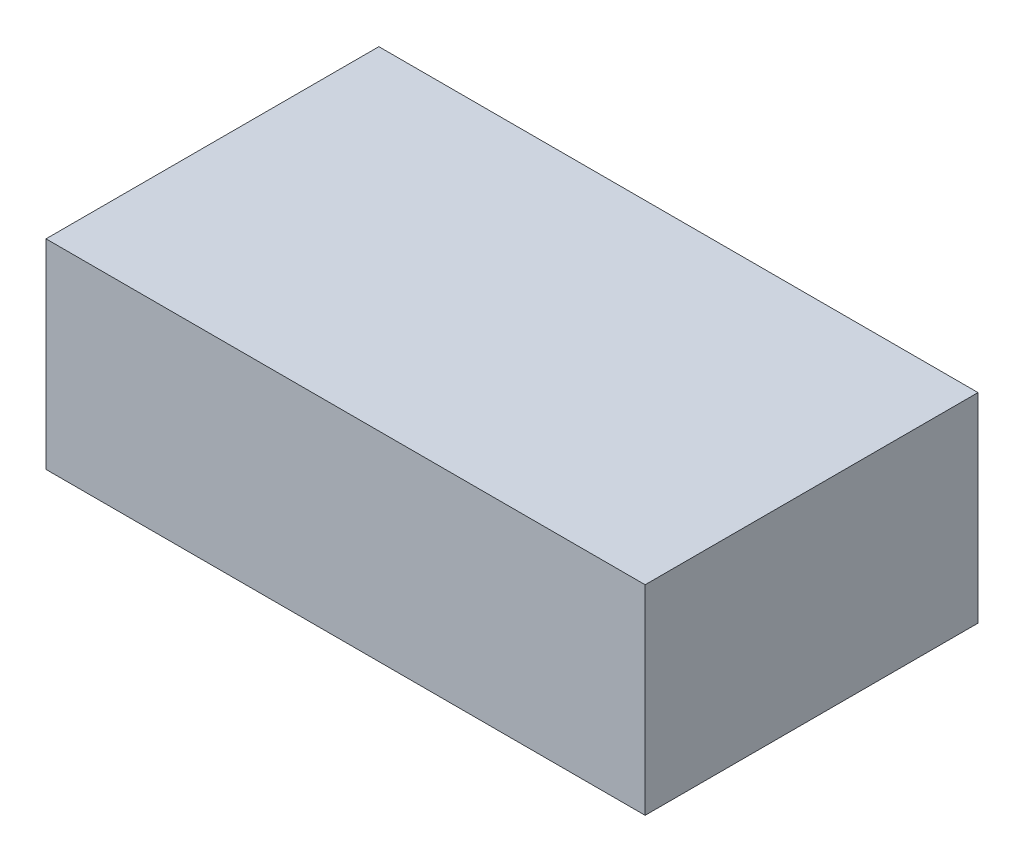
from build123d import *

# Parameters (mm, degrees)
SKETCH_2_W      = 27
SKETCH_2_H      = 9
EXTRUDE_1_DEPTH = 15


with BuildPart() as part:
    # Эскиз2 → Бобышка-Вытянуть1 (new body)
    with BuildSketch(Plane.XY):
        Rectangle(SKETCH_2_W, SKETCH_2_H)
    extrude(amount=EXTRUDE_1_DEPTH)


solid = part.part
